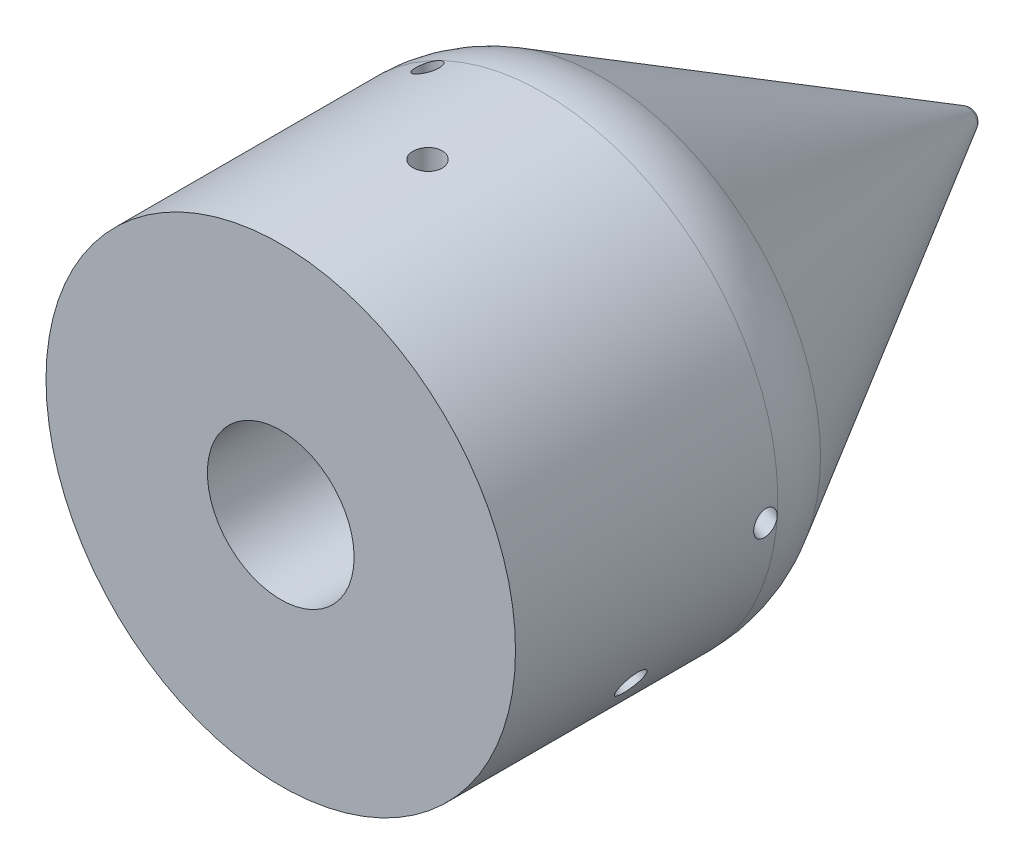
from build123d import *

# Parameters (mm, degrees)
CROQUIS1_R              = 40
CROQUIS1_R_2            = 12.5
SALIENTE_EXTRUIR1_DEPTH = 50
CROQUIS2_R              = 2.5
CORTAR_EXTRUIR1_DEPTH   = 20
CROQUIS3_R              = 2.5
CORTAR_EXTRUIR2_DEPTH   = 20
CROQUIS4_R              = 2.5
CORTAR_EXTRUIR3_DEPTH   = 20
CROQUIS5_R              = 2
CORTAR_EXTRUIR4_DEPTH   = 20
CROQUIS6_R              = 2
CORTAR_EXTRUIR5_DEPTH   = 20
CROQUIS7_R              = 2
CORTAR_EXTRUIR6_DEPTH   = 20
REDONDEO1_R             = 20


with BuildPart() as part:
    # Croquis1 → Saliente-Extruir1 (new body)
    with BuildSketch(Plane.XY):
        Circle(CROQUIS1_R)
        Circle(CROQUIS1_R_2, mode=Mode.SUBTRACT)
    extrude(amount=SALIENTE_EXTRUIR1_DEPTH)

    # Croquis2 → Cortar-Extruir1 (cut)
    with BuildSketch(Plane(origin=(34.641016151, -20, 0), x_dir=(0, 0, -1), z_dir=(0.8660254037844364, -0.5000000000000041, 0))):
        with Locations(Location((-25, 0, 0), (0, 0, 90))):
            Circle(CROQUIS2_R)
    extrude(amount=-CORTAR_EXTRUIR1_DEPTH, mode=Mode.SUBTRACT)

    # Croquis3 → Cortar-Extruir2 (cut)
    with BuildSketch(Plane(origin=(0, 40, 0), x_dir=(1, 0, 0), z_dir=(0, 1, 0))):
        with Locations(Location((0, -25, 0), (0, 0, 270))):
            Circle(CROQUIS3_R)
    extrude(amount=-CORTAR_EXTRUIR2_DEPTH, mode=Mode.SUBTRACT)

    # Croquis4 → Cortar-Extruir3 (cut)
    with BuildSketch(Plane(origin=(-34.641016151, -20, 0), x_dir=(0, 0, -1), z_dir=(-0.8660254037844398, -0.499999999999998, 0))):
        with Locations(Location((-25, 0, 0), (0, 0, 90))):
            Circle(CROQUIS4_R)
    extrude(amount=-CORTAR_EXTRUIR3_DEPTH, mode=Mode.SUBTRACT)

    # Croquis5 → Cortar-Extruir4 (cut)
    with BuildSketch(Plane(origin=(-34.641016151, -20, 0), x_dir=(0, 0, -1), z_dir=(-0.8660254037844398, -0.499999999999998, 0))):
        with Locations(Location((-7.32233047, 17.67766953, 0), (0, 0, 90))):
            Circle(CROQUIS5_R)
    extrude(amount=-CORTAR_EXTRUIR4_DEPTH, mode=Mode.SUBTRACT)

    # Croquis6 → Cortar-Extruir5 (cut)
    with BuildSketch(Plane(origin=(34.641016151, -20, 0), x_dir=(0, 0, -1), z_dir=(0.8660254037844364, -0.5000000000000041, 0))):
        with Locations(Location((-7.32233047, 17.67766953, 0), (0, 0, 90))):
            Circle(CROQUIS6_R)
    extrude(amount=-CORTAR_EXTRUIR5_DEPTH, mode=Mode.SUBTRACT)

    # Croquis7 → Cortar-Extruir6 (cut)
    with BuildSketch(Plane(origin=(0, 40, 0), x_dir=(1, 0, 0), z_dir=(0, 1, 0))):
        with Locations(Location((-17.67766953, -7.32233047, 0), (0, 0, 270))):
            Circle(CROQUIS7_R)
    extrude(amount=-CORTAR_EXTRUIR6_DEPTH, mode=Mode.SUBTRACT)

    # Croquis8 → Revolución1 (revolve)
    with BuildSketch(Plane(origin=(0, 0, 0), x_dir=(1, 0, 0), z_dir=(0, 1, 0))):
        with BuildLine():
            Line((0, 0), (40, 0))
            Line((40, 0), (1.723076923, 66.984615385))
            ThreePointArc((1.723076923, 66.984615385), (0.996101755, 67.716462301), (0, 67.984555753))
            Line((0, 67.984555753), (0, 64.015444247))
            Line((0, 64.015444247), (0, 0))
        make_face()
    revolve(axis=Axis((0, 0, 0), (0, 0, -1)))

    # Redondeo1
    redondeo1_edges = [part.edges().sort_by_distance(p)[0] for p in [
        (-40, 0, 0),
    ]]
    fillet(redondeo1_edges, radius=REDONDEO1_R)


solid = part.part
